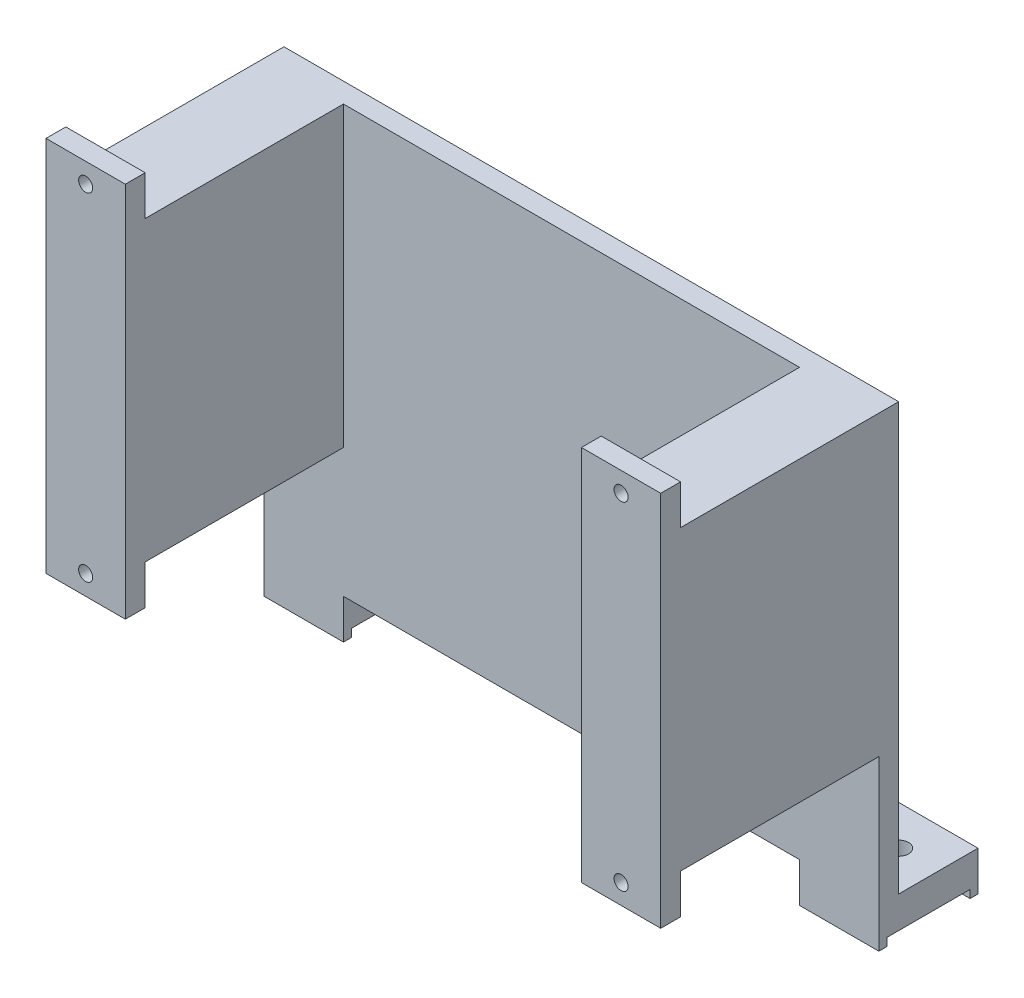
from build123d import *

# Parameters (mm, degrees)
SKETCH1_W                   = 196.85
SKETCH1_H                   = 82.55
BOSS_EXTRUDE1_DEPTH         = 95.25
SKETCH3_W                   = 146.05
SKETCH3_H                   = 76.2
CUT_EXTRUDE1_DEPTH          = 144.051280141
SKETCH4_W                   = 25.4
SKETCH4_H                   = 53.975
BOSS_EXTRUDE2_DEPTH         = 6.35
SKETCH5_W                   = 25.4
SKETCH5_H                   = 12.7
BOSS_EXTRUDE3_DEPTH         = 25.4
SKETCH6_W                   = 26.67
SKETCH6_H                   = 2.54
CUT_EXTRUDE2_DEPTH          = 229.622047548
F_1_4_0_25_DIAMETER_HOLE1_D = 6.35
SKETCH16_W                  = 196.85
SKETCH16_H                  = 6.35
CUT_EXTRUDE3_DEPTH          = 191.790819682
BOSS_EXTRUDE4_START         = -6.35
SKETCH11_W                  = 25.4
SKETCH11_H                  = 12.7
BOSS_EXTRUDE4_DEPTH         = 6.35
F_8_CLEARANCE_HOLE1_D       = 4.4958
F_8_CLEARANCE_HOLE1_DEPTH   = 12.7
SKETCH14_W                  = 146.05
SKETCH14_H                  = 41.275
BOSS_EXTRUDE5_DEPTH         = 6.35


with BuildPart() as part:
    # Sketch1 → Boss-Extrude1 (new body)
    with BuildSketch(Plane(origin=(0, 0, 0), x_dir=(1, 0, 0), z_dir=(0, 1, 0))):
        Rectangle(SKETCH1_W, SKETCH1_H)
    extrude(amount=BOSS_EXTRUDE1_DEPTH)

    # Sketch3 → Cut-Extrude1 (cut, through all)
    with BuildSketch(Plane(origin=(0, 95.25, 0), x_dir=(1, 0, 0), z_dir=(0, 1, 0))):
        with Locations((0, -3.175)):
            Rectangle(SKETCH3_W, SKETCH3_H)
    extrude(amount=-CUT_EXTRUDE1_DEPTH, mode=Mode.SUBTRACT)

    # Sketch4 → Boss-Extrude2 (add)
    with BuildSketch(Plane(origin=(0, 0, -41.275), x_dir=(-1, 0, 0), z_dir=(0, 0, -1))):
        with Locations((-85.725, -26.9875)):
            Rectangle(SKETCH4_W, SKETCH4_H)
    boss_extrude2 = extrude(amount=-BOSS_EXTRUDE2_DEPTH)

    # Sketch5 → Boss-Extrude3 (add)
    with BuildSketch(Plane(origin=(0, 0, -41.275), x_dir=(-1, 0, 0), z_dir=(0, 0, -1))):
        with Locations((-85.725, -47.625)):
            Rectangle(SKETCH5_W, SKETCH5_H)
    boss_extrude3 = extrude(amount=BOSS_EXTRUDE3_DEPTH)

    # Sketch6 → Cut-Extrude2 (cut, through all)
    with BuildSketch(Plane(origin=(98.425, 0, 0), x_dir=(0, 0, -1), z_dir=(1, 0, 0))):
        with Locations((50.8, -52.705)):
            Rectangle(SKETCH6_W, SKETCH6_H)
    cut_extrude2 = extrude(amount=-CUT_EXTRUDE2_DEPTH, mode=Mode.SUBTRACT)

    # 1/4 (0.25) Diameter Hole1 (through all)
    with Locations(Plane(origin=(0, -41.275, 0), x_dir=(1, 0, 0), z_dir=(0, 1, 0))):
        with Locations((85.725, 53.975)):
            f_1_4_0_25_diameter_hole1 = Hole(F_1_4_0_25_DIAMETER_HOLE1_D / 2)

    # Sketch16 → Cut-Extrude3 (cut, through all)
    with BuildSketch(Plane(origin=(0, 95.25, 0), x_dir=(1, 0, 0), z_dir=(0, 1, 0))):
        with Locations((0, -38.1)):
            Rectangle(SKETCH16_W, SKETCH16_H)
    extrude(amount=-CUT_EXTRUDE3_DEPTH, mode=Mode.SUBTRACT)

    # Sketch11 → Boss-Extrude4 (add)
    with BuildSketch(Plane.XY.offset(41.275).offset(BOSS_EXTRUDE4_START)):
        with Locations((85.725, 101.6)):
            Rectangle(SKETCH11_W, SKETCH11_H)
        with Locations((85.725, -6.35)):
            Rectangle(SKETCH11_W, SKETCH11_H)
    boss_extrude4 = extrude(amount=-BOSS_EXTRUDE4_DEPTH)

    # #8 Clearance Hole1
    with Locations(Plane.XY.offset(41.275)):
        with Locations((85.725, 101.6), (85.725, -6.35)):
            f_8_clearance_hole1 = Hole(F_8_CLEARANCE_HOLE1_D / 2, depth=F_8_CLEARANCE_HOLE1_DEPTH)

    # Mirror1: Boss-Extrude2, Boss-Extrude3, Cut-Extrude2, 1/4 (0.25) Diameter Hole1, Boss-Extrude4, #8 Clearance Hole1 across plane
    add(boss_extrude2.mirror(Plane(origin=(0, 0, 0), x_dir=(0, 0, 1), z_dir=(1, 0, 0))))
    add(boss_extrude3.mirror(Plane(origin=(0, 0, 0), x_dir=(0, 0, 1), z_dir=(1, 0, 0))))
    add(cut_extrude2.mirror(Plane(origin=(0, 0, 0), x_dir=(0, 0, 1), z_dir=(1, 0, 0))), mode=Mode.SUBTRACT)
    add(f_1_4_0_25_diameter_hole1.mirror(Plane(origin=(0, 0, 0), x_dir=(0, 0, 1), z_dir=(1, 0, 0))), mode=Mode.SUBTRACT)
    add(boss_extrude4.mirror(Plane(origin=(0, 0, 0), x_dir=(0, 0, 1), z_dir=(1, 0, 0))))
    add(f_8_clearance_hole1.mirror(Plane(origin=(0, 0, 0), x_dir=(0, 0, 1), z_dir=(1, 0, 0))), mode=Mode.SUBTRACT)

    # Sketch14 → Boss-Extrude5 (add)
    with BuildSketch(Plane(origin=(0, 0, -41.275), x_dir=(-1, 0, 0), z_dir=(0, 0, -1))):
        with Locations((0, -20.6375)):
            Rectangle(SKETCH14_W, SKETCH14_H)
    extrude(amount=-BOSS_EXTRUDE5_DEPTH)


solid = part.part
